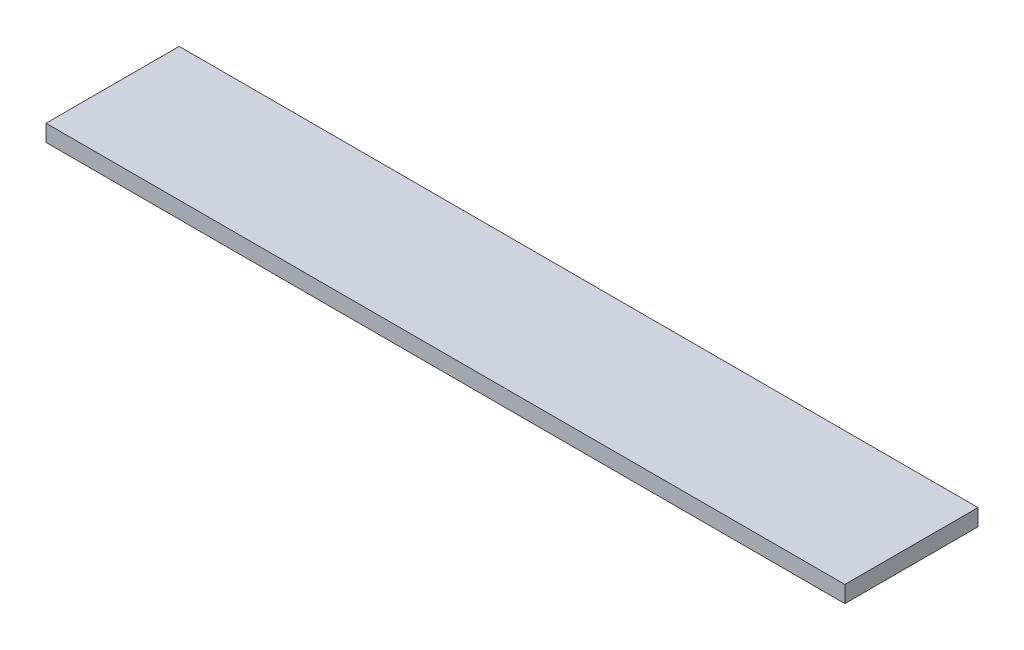
from build123d import *

# Parameters (mm, degrees)
SKETCH1_W           = 76.2
SKETCH1_H           = 12.7
BOSS_EXTRUDE1_DEPTH = 1.5875


with BuildPart() as part:
    # Sketch1 → Boss-Extrude1 (new body)
    with BuildSketch(Plane(origin=(0, 0, 0), x_dir=(1, 0, 0), z_dir=(0, 1, 0))):
        Rectangle(SKETCH1_W, SKETCH1_H)
    extrude(amount=BOSS_EXTRUDE1_DEPTH)


solid = part.part
